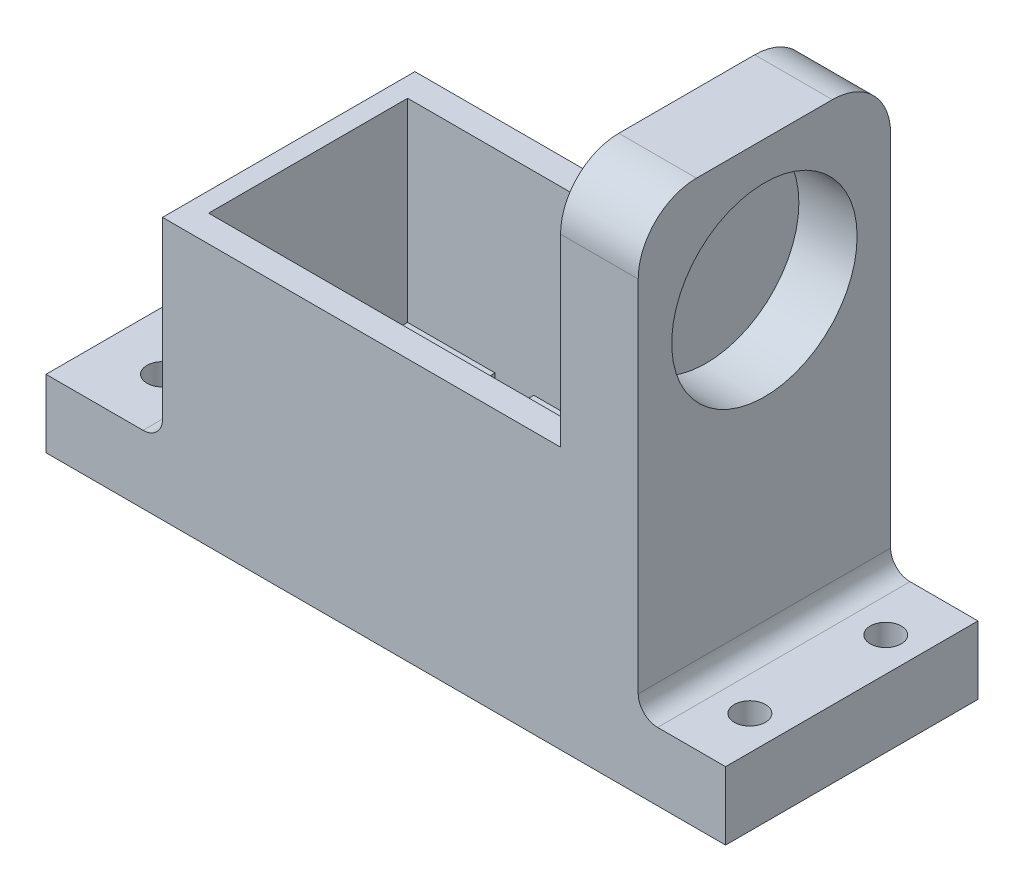
from build123d import *

# Parameters (mm, degrees)
ESQUISSE1_W             = 70
ESQUISSE1_H             = 26
BOSS_EXTRU_1_DEPTH      = 7
ESQUISSE2_W             = 8
ESQUISSE2_H             = 26
BOSS_EXTRU_2_DEPTH      = 45
BOSS_EXTRU_3_DEPTH      = 20
ENL_V_MAT_EXTRU_1_REACH = 89.184
ESQUISSE4_W             = 4
ESQUISSE4_H             = 20.5
CONG_1_R                = 1
CONG_2_R                = 2
ENL_V_MAT_EXTRU_2_REACH = 89.184
ESQUISSE5_R             = 1.6
CONG_3_R                = 6
ESQUISSE6_R             = 9.55
ENL_V_MAT_EXTRU_3_DEPTH = 6


with BuildPart() as part:
    # Esquisse1 → Boss.-Extru.1 (new body)
    with BuildSketch(Plane(origin=(0, 0, 0), x_dir=(1, 0, 0), z_dir=(0, 1, 0))):
        with Locations((35, 13)):
            Rectangle(ESQUISSE1_W, ESQUISSE1_H)
    extrude(amount=BOSS_EXTRU_1_DEPTH)

    # Esquisse2 → Boss.-Extru.2 (add)
    with BuildSketch(Plane(origin=(0, 7, 0), x_dir=(1, 0, 0), z_dir=(0, 1, 0))):
        with Locations((57, 13)):
            Rectangle(ESQUISSE2_W, ESQUISSE2_H)
    extrude(amount=BOSS_EXTRU_2_DEPTH)

    # Esquisse3 → Boss.-Extru.3 (add)
    with BuildSketch(Plane(origin=(0, 7, 0), x_dir=(1, 0, 0), z_dir=(0, 1, 0))):
        Polygon((53, 26), (12, 26), (12, 0), (53, 0), (53, 2.75), (14, 2.75), (14, 23.25), (53, 23.25), align=None)
    extrude(amount=BOSS_EXTRU_3_DEPTH)

    # Esquisse4 → Enlèv. mat.-Extru.1 (cut, up to next)
    with BuildSketch(Plane(origin=(0, 7, 0), x_dir=(1, 0, 0), z_dir=(0, 1, 0)), mode=Mode.PRIVATE) as enl_v_mat_extru_1_sk1:
        with Locations((25, 13)):
            Rectangle(ESQUISSE4_W, ESQUISSE4_H)
    enl_v_mat_extru_1_tool1 = extrude(enl_v_mat_extru_1_sk1.sketch, amount=-ENL_V_MAT_EXTRU_1_REACH, mode=Mode.PRIVATE) & part.part
    add(enl_v_mat_extru_1_tool1.solids().sort_by_distance((25, 7, -13))[0], mode=Mode.SUBTRACT)

    # Congé1
    cong_1_edges = [part.edges().sort_by_distance(p)[0] for p in [
        (53, 7, -13),
    ]]
    fillet(cong_1_edges, radius=CONG_1_R)

    # Congé2
    cong_2_edges = [part.edges().sort_by_distance(p)[0] for p in [
        (61, 7, -13),
        (12, 7, -13),
    ]]
    fillet(cong_2_edges, radius=CONG_2_R)

    # Esquisse5 → Enlèv. mat.-Extru.2 (cut, up to next)
    with BuildSketch(Plane(origin=(0, 7, 0), x_dir=(1, 0, 0), z_dir=(0, 1, 0)), mode=Mode.PRIVATE) as enl_v_mat_extru_2_sk1:
        with Locations(Location((6, 20, 0), (0, 0, 270))):
            Circle(ESQUISSE5_R)
    enl_v_mat_extru_2_tool1 = extrude(enl_v_mat_extru_2_sk1.sketch, amount=-ENL_V_MAT_EXTRU_2_REACH, mode=Mode.PRIVATE) & part.part
    # Esquisse5 → Enlèv. mat.-Extru.2 (cut, up to next)
    with BuildSketch(Plane(origin=(0, 7, 0), x_dir=(1, 0, 0), z_dir=(0, 1, 0)), mode=Mode.PRIVATE) as enl_v_mat_extru_2_sk2:
        with Locations(Location((66.5, 20, 0), (0, 0, 270))):
            Circle(ESQUISSE5_R)
    enl_v_mat_extru_2_tool2 = extrude(enl_v_mat_extru_2_sk2.sketch, amount=-ENL_V_MAT_EXTRU_2_REACH, mode=Mode.PRIVATE) & part.part
    # Esquisse5 → Enlèv. mat.-Extru.2 (cut, up to next)
    with BuildSketch(Plane(origin=(0, 7, 0), x_dir=(1, 0, 0), z_dir=(0, 1, 0)), mode=Mode.PRIVATE) as enl_v_mat_extru_2_sk3:
        with Locations(Location((66.5, 6, 0), (0, 0, 90))):
            Circle(ESQUISSE5_R)
    enl_v_mat_extru_2_tool3 = extrude(enl_v_mat_extru_2_sk3.sketch, amount=-ENL_V_MAT_EXTRU_2_REACH, mode=Mode.PRIVATE) & part.part
    # Esquisse5 → Enlèv. mat.-Extru.2 (cut, up to next)
    with BuildSketch(Plane(origin=(0, 7, 0), x_dir=(1, 0, 0), z_dir=(0, 1, 0)), mode=Mode.PRIVATE) as enl_v_mat_extru_2_sk4:
        with Locations(Location((6, 6, 0), (0, 0, 90))):
            Circle(ESQUISSE5_R)
    enl_v_mat_extru_2_tool4 = extrude(enl_v_mat_extru_2_sk4.sketch, amount=-ENL_V_MAT_EXTRU_2_REACH, mode=Mode.PRIVATE) & part.part
    add(enl_v_mat_extru_2_tool1.solids().sort_by_distance((6, 7, -20))[0], mode=Mode.SUBTRACT)
    add(enl_v_mat_extru_2_tool2.solids().sort_by_distance((66.5, 7, -20))[0], mode=Mode.SUBTRACT)
    add(enl_v_mat_extru_2_tool3.solids().sort_by_distance((66.5, 7, -6))[0], mode=Mode.SUBTRACT)
    add(enl_v_mat_extru_2_tool4.solids().sort_by_distance((6, 7, -6))[0], mode=Mode.SUBTRACT)

    # Congé3
    cong_3_edges = [part.edges().sort_by_distance(p)[0] for p in [
        (57, 52, -26),
        (57, 52, 0),
    ]]
    fillet(cong_3_edges, radius=CONG_3_R)

    # Esquisse6 → Enlèv. mat.-Extru.3 (cut)
    with BuildSketch(Plane(origin=(61, 0, 0), x_dir=(0, 0, -1), z_dir=(1, 0, 0))):
        with Locations((13, 38.53)):
            Circle(ESQUISSE6_R)
    extrude(amount=-ENL_V_MAT_EXTRU_3_DEPTH, mode=Mode.SUBTRACT)


solid = part.part
